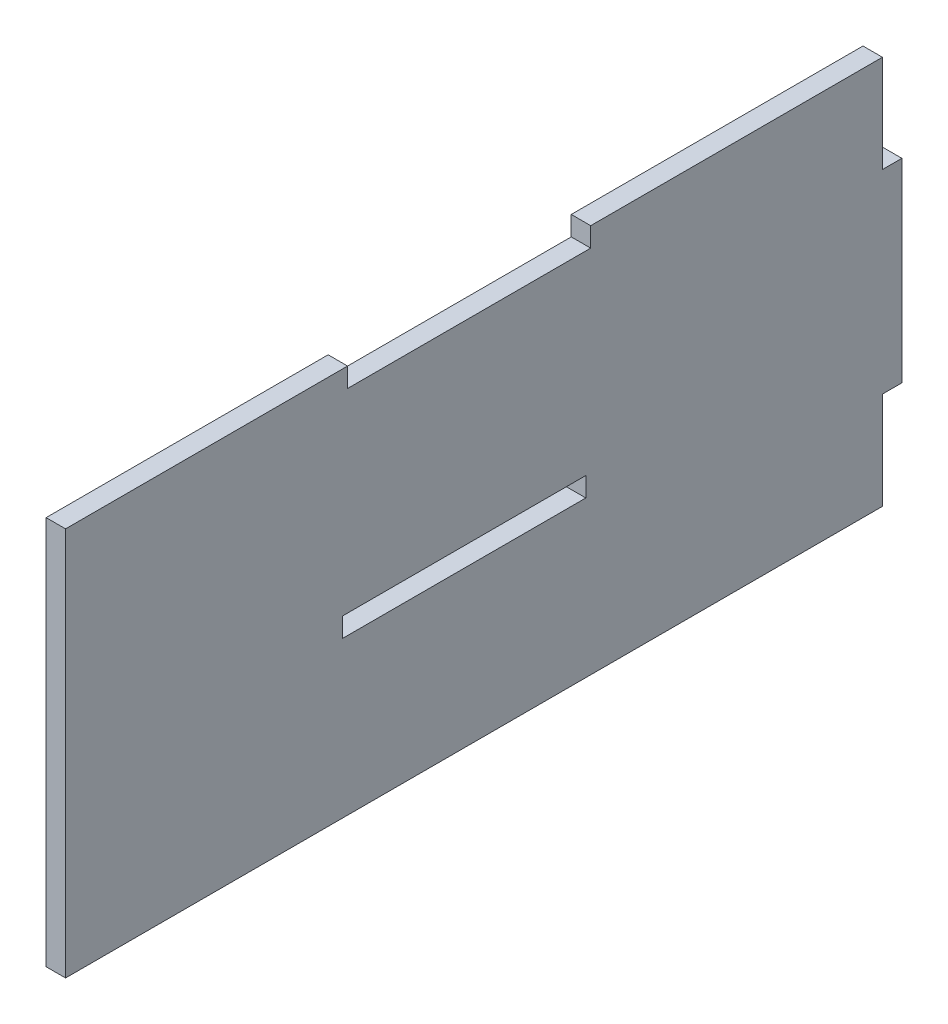
from build123d import *

# Parameters (mm, degrees)
SKETCH_1_W          = 174
SKETCH_1_H          = 80
EXTRUDE_1_DEPTH     = 4
SKETCH_3_W          = 4
SKETCH_3_H          = 20
CUT_EXTRUDE_1_DEPTH = 4
SKETCH_4_W          = 50
SKETCH_4_H          = 4
CUT_EXTRUDE_2_DEPTH = 4
SKETCH_5_W          = 2
SKETCH_5_H          = 80
CUT_EXTRUDE_3_DEPTH = 10
SKETCH_6_W          = 50
SKETCH_6_H          = 4
CUT_EXTRUDE_4_DEPTH = 4


with BuildPart() as part:
    # 스케치1 → 보스-돌출1 (new body)
    with BuildSketch(Plane(origin=(0, 0, 0), x_dir=(0, 0, -1), z_dir=(1, 0, 0))):
        Rectangle(SKETCH_1_W, SKETCH_1_H)
    extrude(amount=EXTRUDE_1_DEPTH)

    # 스케치3 → 컷-돌출1 (cut)
    with BuildSketch(Plane(origin=(4, 0, 0), x_dir=(0, 0, -1), z_dir=(1, 0, 0))):
        with Locations((85, 30)):
            Rectangle(SKETCH_3_W, SKETCH_3_H)
        with Locations((85, -30)):
            Rectangle(SKETCH_3_W, SKETCH_3_H)
    extrude(amount=-CUT_EXTRUDE_1_DEPTH, mode=Mode.SUBTRACT)

    # 스케치4 → 컷-돌출2 (cut)
    with BuildSketch(Plane(origin=(4, 0, 0), x_dir=(0, 0, -1), z_dir=(1, 0, 0))):
        with Locations((-2, 38)):
            Rectangle(SKETCH_4_W, SKETCH_4_H)
    extrude(amount=-CUT_EXTRUDE_2_DEPTH, mode=Mode.SUBTRACT)

    # 스케치5 → 컷-돌출3 (cut)
    with BuildSketch(Plane(origin=(4, 0, 0), x_dir=(0, 0, -1), z_dir=(1, 0, 0))):
        with Locations((-86, 0)):
            Rectangle(SKETCH_5_W, SKETCH_5_H)
    extrude(amount=-CUT_EXTRUDE_3_DEPTH, mode=Mode.SUBTRACT)

    # 스케치6 → 컷-돌출4 (cut)
    with BuildSketch(Plane(origin=(4, 0, 0), x_dir=(0, 0, -1), z_dir=(1, 0, 0))):
        with Locations((-3, -6)):
            Rectangle(SKETCH_6_W, SKETCH_6_H)
    extrude(amount=-CUT_EXTRUDE_4_DEPTH, mode=Mode.SUBTRACT)


solid = part.part
